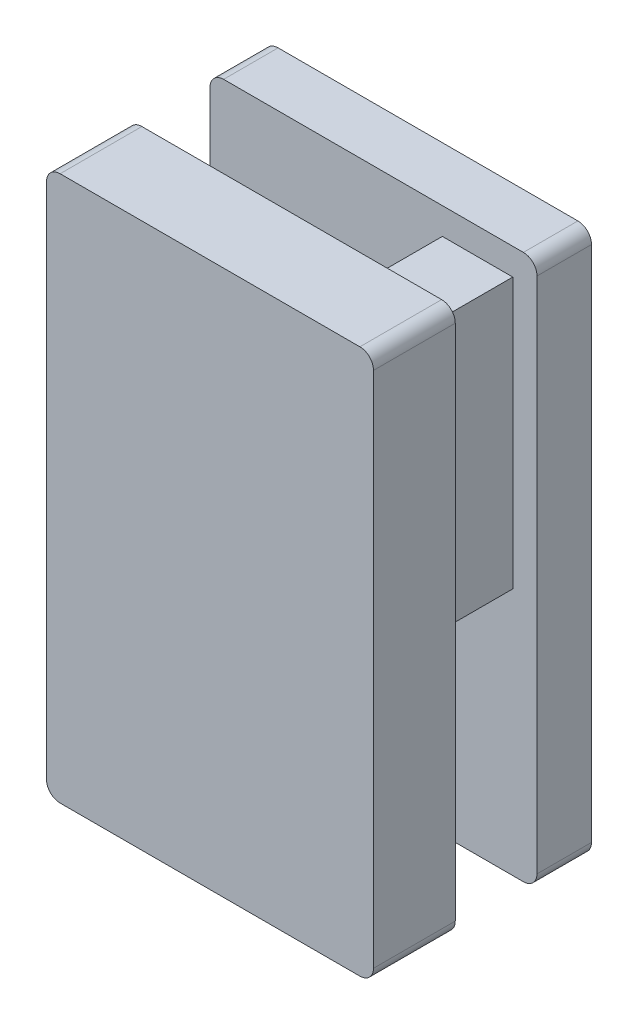
from build123d import *

# Parameters (mm, degrees)
SKETCH1_W           = 12
SKETCH1_H           = 20
BOSS_EXTRUDE1_DEPTH = 2
SKETCH2_W           = 2.583613584
SKETCH2_H           = 9.909750732
BOSS_EXTRUDE2_DEPTH = 3
SKETCH3_W           = 12
SKETCH3_H           = 20
BOSS_EXTRUDE3_DEPTH = 3
FILLET1_R           = 0.5


with BuildPart() as part:
    # Sketch1 → Boss-Extrude1 (new body)
    with BuildSketch(Plane.XY):
        with Locations((68.585871194, -163)):
            Rectangle(SKETCH1_W, SKETCH1_H)
    extrude(amount=BOSS_EXTRUDE1_DEPTH)

    # Sketch2 → Boss-Extrude2 (add)
    with BuildSketch(Plane.XY.offset(2)):
        with Locations((72.404631484, -158.933321579)):
            Rectangle(SKETCH2_W, SKETCH2_H)
    extrude(amount=BOSS_EXTRUDE2_DEPTH)

    # Sketch3 → Boss-Extrude3 (add)
    with BuildSketch(Plane.XY.offset(5)):
        with Locations((68.585871194, -163)):
            Rectangle(SKETCH3_W, SKETCH3_H)
    extrude(amount=BOSS_EXTRUDE3_DEPTH)

    # Fillet1
    fillet1_edges = [part.edges().sort_by_distance(p)[0] for p in [
        (62.585871194, -173, 6.5),
        (74.585871194, -173, 6.5),
        (74.585871194, -153, 6.5),
        (62.585871194, -153, 6.5),
        (62.585871194, -153, 1),
        (74.585871194, -153, 1),
        (74.585871194, -173, 1),
        (62.585871194, -173, 1),
    ]]
    fillet(fillet1_edges, radius=FILLET1_R)


solid = part.part
